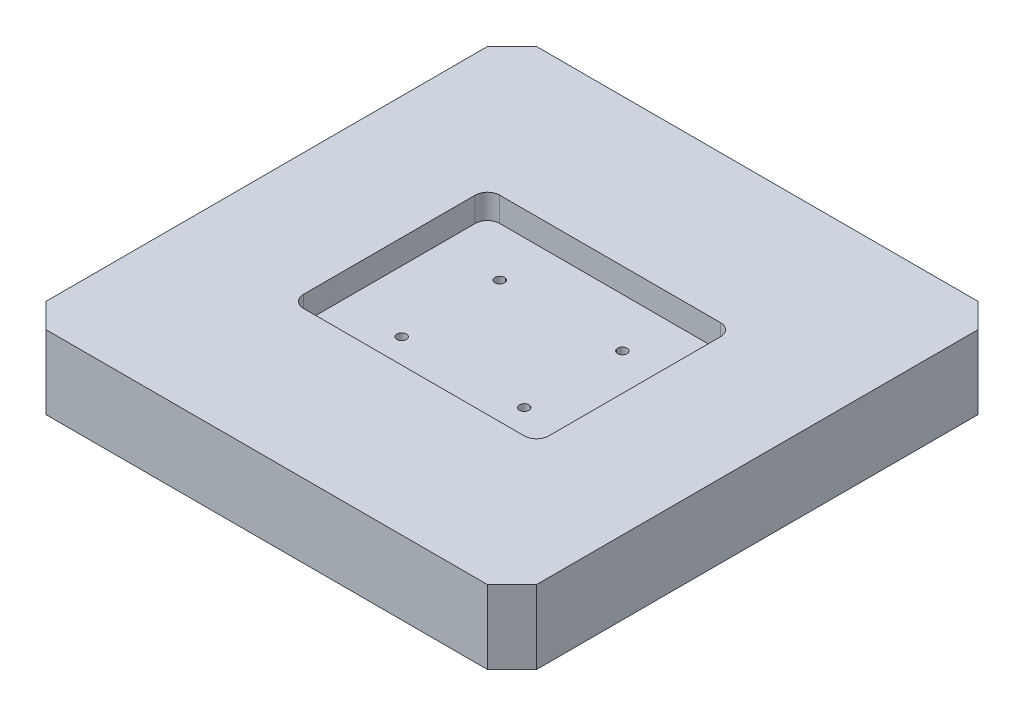
from build123d import *

# Parameters (mm, degrees)
SKETCH1_W               = 254
SKETCH1_H               = 254
BOSS_EXTRUDE1_DEPTH     = 38.1
CUT_EXTRUDE1_DEPTH      = 12.7
CUT_EXTRUDE2_DEPTH      = 361.10715072
CUT_EXTRUDE2_DEPTH_BACK = 361.10715072
SKETCH4_R               = 2.4638
CHAMFER1_SIZE           = 12.7


with BuildPart() as part:
    # Sketch1 → Boss-Extrude1 (new body)
    with BuildSketch(Plane(origin=(0, 0, 0), x_dir=(1, 0, 0), z_dir=(0, 1, 0))):
        with Locations((127, 127)):
            Rectangle(SKETCH1_W, SKETCH1_H)
    extrude(amount=BOSS_EXTRUDE1_DEPTH)

    # Sketch2 → Cut-Extrude1 (cut)
    with BuildSketch(Plane(origin=(0, 38.1, 0), x_dir=(1, 0, 0), z_dir=(0, 1, 0))):
        with BuildLine():
            Line((69.85, 76.2), (184.15, 76.2))
            ThreePointArc((184.15, 76.2), (188.640128061, 78.059871939), (190.5, 82.55))
            Line((190.5, 82.55), (190.5, 171.45))
            ThreePointArc((190.5, 171.45), (188.640128061, 175.940128061), (184.15, 177.8))
            Line((184.15, 177.8), (69.85, 177.8))
            ThreePointArc((69.85, 177.8), (65.359871939, 175.940128061), (63.5, 171.45))
            Line((63.5, 171.45), (63.5, 82.55))
            ThreePointArc((63.5, 82.55), (65.359871939, 78.059871939), (69.85, 76.2))
        make_face()
    extrude(amount=-CUT_EXTRUDE1_DEPTH, mode=Mode.SUBTRACT)

    # Sketch4 → Cut-Extrude2 (cut, two sides: drawn at the far end of the back side and taken through both)
    with BuildSketch(Plane(origin=(0, 25.4, 0), x_dir=(1, 0, 0), z_dir=(0, 1, 0)).offset(-CUT_EXTRUDE2_DEPTH_BACK)):
        with Locations(Location((95.25, 152.4, 0), (0, 0, 270))):
            Circle(SKETCH4_R)
        with Locations(Location((158.75, 152.4, 0), (0, 0, 270))):
            Circle(SKETCH4_R)
        with Locations(Location((158.75, 101.6, 0), (0, 0, 270))):
            Circle(SKETCH4_R)
        with Locations(Location((95.25, 101.6, 0), (0, 0, 270))):
            Circle(SKETCH4_R)
    extrude(amount=CUT_EXTRUDE2_DEPTH + CUT_EXTRUDE2_DEPTH_BACK, mode=Mode.SUBTRACT)

    # Chamfer1
    chamfer1_edges = [part.edges().sort_by_distance(p)[0] for p in [
        (0, 19.05, -254),
        (0, 19.05, 0),
        (254, 19.05, 0),
        (254, 19.05, -254),
    ]]
    chamfer(chamfer1_edges, length=CHAMFER1_SIZE)


solid = part.part
